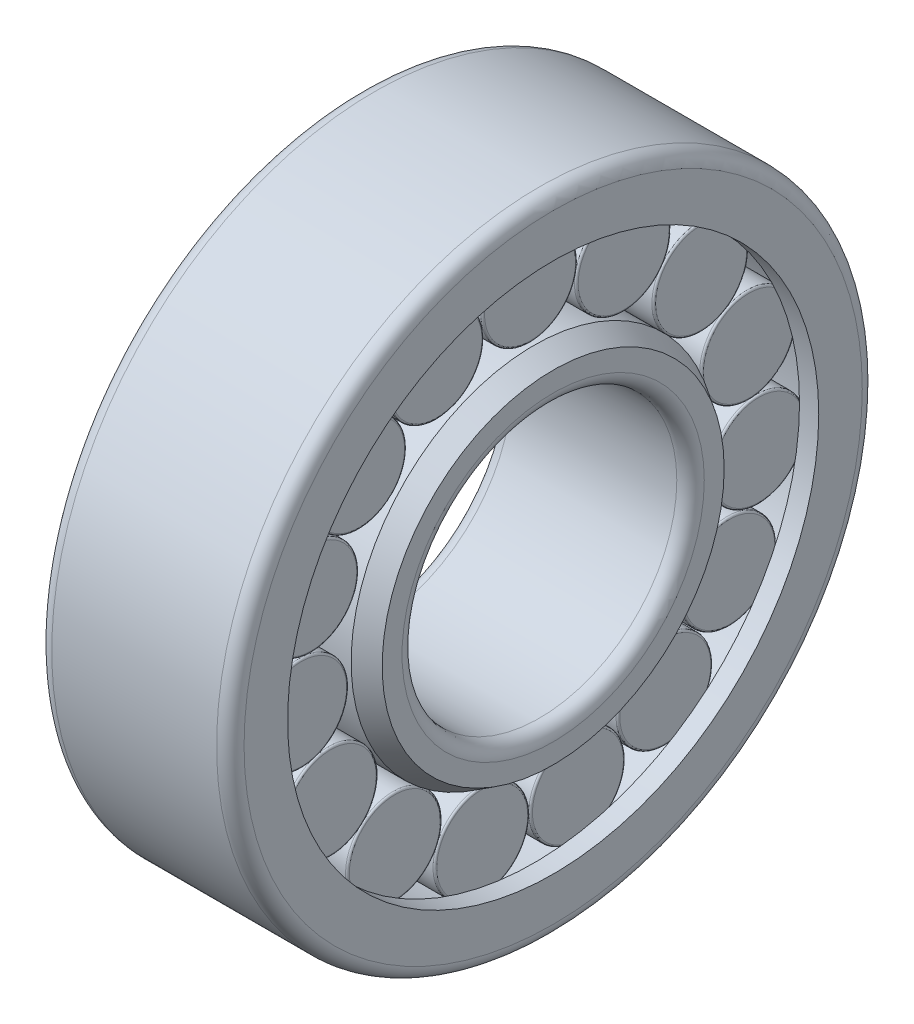
from build123d import *

# Parameters (mm, degrees)
ROLLERSDETAILED_COUNT = 15
ROLLERSDETAILED_ANGLE = 336


with BuildPart() as part:
    # OutRacSke → OuterRace (revolve)
    with BuildSketch(Plane.XY, mode=Mode.PRIVATE) as outerrace_sk:
        with BuildLine():
            Line((-5.6, 19.331875), (-7, 19.331875))
            Line((-7, 19.331875), (-7, 22.5))
            ThreePointArc((-7, 22.5), (-6.707106781, 23.207106781), (-6, 23.5))
            Line((-6, 23.5), (6, 23.5))
            ThreePointArc((6, 23.5), (6.707106781, 23.207106781), (7, 22.5))
            Line((7, 22.5), (7, 19.331875))
            Line((7, 19.331875), (5.6, 19.331875))
            Line((5.6, 19.331875), (5.6, 20.1925))
            Line((5.6, 20.1925), (-5.6, 20.1925))
            Line((-5.6, 20.1925), (-5.6, 19.331875))
        make_face()
    revolve(outerrace_sk.sketch.rotate(Axis((-90, 0, 0), (1, 0, 0)), 270), axis=Axis((-90, 0, 0), (1, 0, 0)))

    # RolDetSke → RollerDetailed (revolve)
    with BuildSketch(Plane.XY, mode=Mode.PRIVATE) as rollerdetailed_sk:
        with BuildLine():
            Line((-5.32, 20.0596), (-5.32, 16.75))
            Line((-5.32, 16.75), (5.32, 16.75))
            Line((5.32, 16.75), (5.32, 20.0596))
            ThreePointArc((5.32, 20.0596), (5.279610025, 20.157110025), (5.1821, 20.1975))
            Line((5.1821, 20.1975), (-5.1821, 20.1975))
            ThreePointArc((-5.1821, 20.1975), (-5.279610025, 20.157110025), (-5.32, 20.0596))
        make_face()
    rollerdetailed = revolve(rollerdetailed_sk.sketch.rotate(Axis((-33.6, 16.75, 0), (1, 0, 0)), 270), axis=Axis((-33.6, 16.75, 0), (1, 0, 0)))

    # InsRacSke → InnerRace (revolve)
    with BuildSketch(Plane.XY, mode=Mode.PRIVATE) as innerrace_sk:
        with BuildLine():
            Line((-5.6, 13.3075), (-7, 12.446875))
            Line((-7, 12.446875), (-7, 11))
            ThreePointArc((-7, 11), (-6.707106781, 10.292893219), (-6, 10))
            Line((-6, 10), (6, 10))
            ThreePointArc((6, 10), (6.707106781, 10.292893219), (7, 11))
            Line((7, 11), (7, 12.446875))
            Line((7, 12.446875), (5.6, 13.3075))
            Line((5.6, 13.3075), (-5.6, 13.3075))
        make_face()
    revolve(innerrace_sk.sketch.rotate(Axis((-90, 0, 0), (1, 0, 0)), 270), axis=Axis((-90, 0, 0), (1, 0, 0)))

    # RollersDetailed: RollerDetailed ×15 about axis
    rollersdetailed_axis = Axis((-50, 0, 0), (1, 0, 0))
    for i in range(1, ROLLERSDETAILED_COUNT):
        add(rollerdetailed.rotate(rollersdetailed_axis, i * ROLLERSDETAILED_ANGLE / (ROLLERSDETAILED_COUNT - 1)))


solid = part.part
